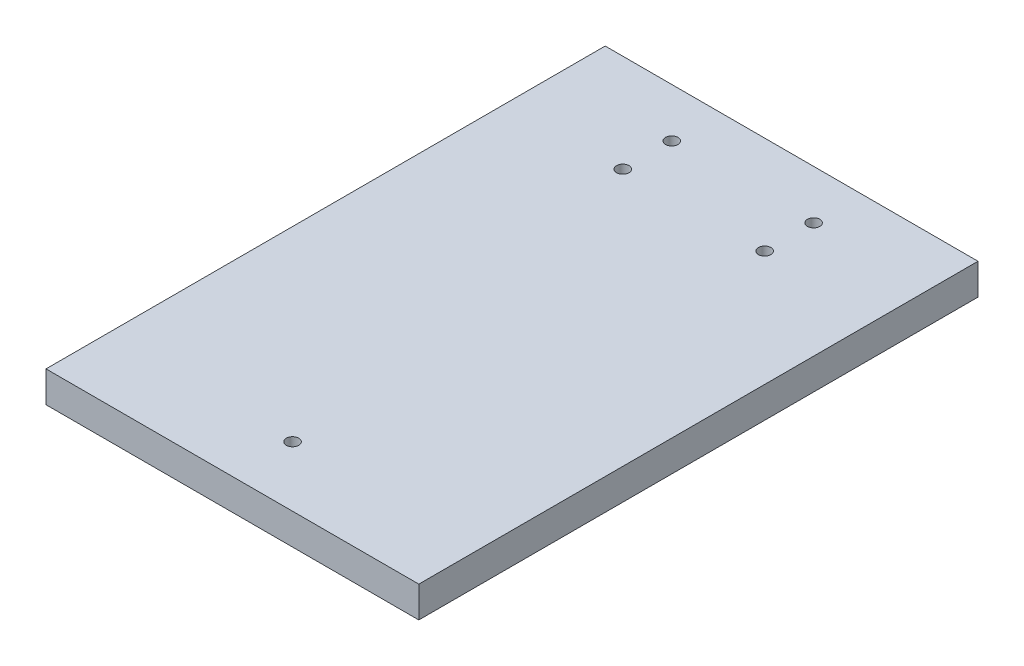
from build123d import *

# Parameters (mm, degrees)
SKETCH1_W           = 76.2
SKETCH1_H           = 114.3
SKETCH1_R           = 1.27
BOSS_EXTRUDE1_DEPTH = 6.35


with BuildPart() as part:
    # Sketch1 → Boss-Extrude1 (new body)
    with BuildSketch(Plane(origin=(0, 0, 0), x_dir=(1, 0, 0), z_dir=(0, 1, 0))):
        Rectangle(SKETCH1_W, SKETCH1_H)
        with Locations(Location((-14.5, 47.15, 0), (0, 0, 270))):
            Circle(SKETCH1_R, mode=Mode.SUBTRACT)
        with Locations(Location((14.5, 47.15, 0), (0, 0, 270))):
            Circle(SKETCH1_R, mode=Mode.SUBTRACT)
        with Locations(Location((0, -44.85, 0), (0, 0, 270))):
            Circle(SKETCH1_R, mode=Mode.SUBTRACT)
        with Locations(Location((-14.5, 37.15, 0), (0, 0, 270))):
            Circle(SKETCH1_R, mode=Mode.SUBTRACT)
        with Locations(Location((14.5, 37.15, 0), (0, 0, 270))):
            Circle(SKETCH1_R, mode=Mode.SUBTRACT)
    extrude(amount=BOSS_EXTRUDE1_DEPTH)


solid = part.part
